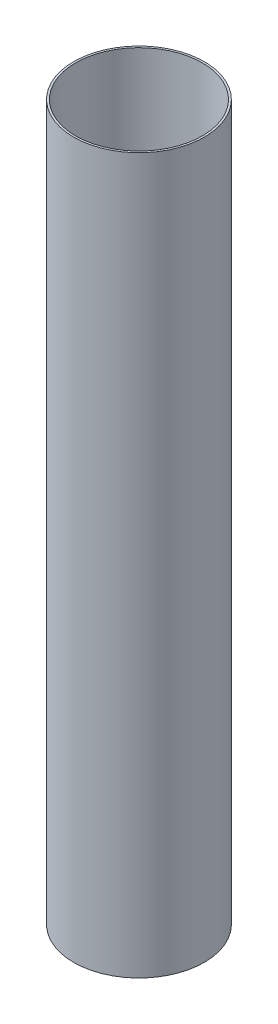
from build123d import *

# Parameters (mm, degrees)
SKETCH1_R           = 51.1048
SKETCH1_R_2         = 49.53
BOSS_EXTRUDE1_DEPTH = 558.8


with BuildPart() as part:
    # Sketch1 → Boss-Extrude1 (new body)
    with BuildSketch(Plane(origin=(0, 0, 0), x_dir=(1, 0, 0), z_dir=(0, 1, 0))):
        with Locations(Location((0, 0, 0), (0, 0, 270))):
            Circle(SKETCH1_R)
        with Locations(Location((0, 0, 0), (0, 0, 270))):
            Circle(SKETCH1_R_2, mode=Mode.SUBTRACT)
    extrude(amount=BOSS_EXTRUDE1_DEPTH)


solid = part.part
